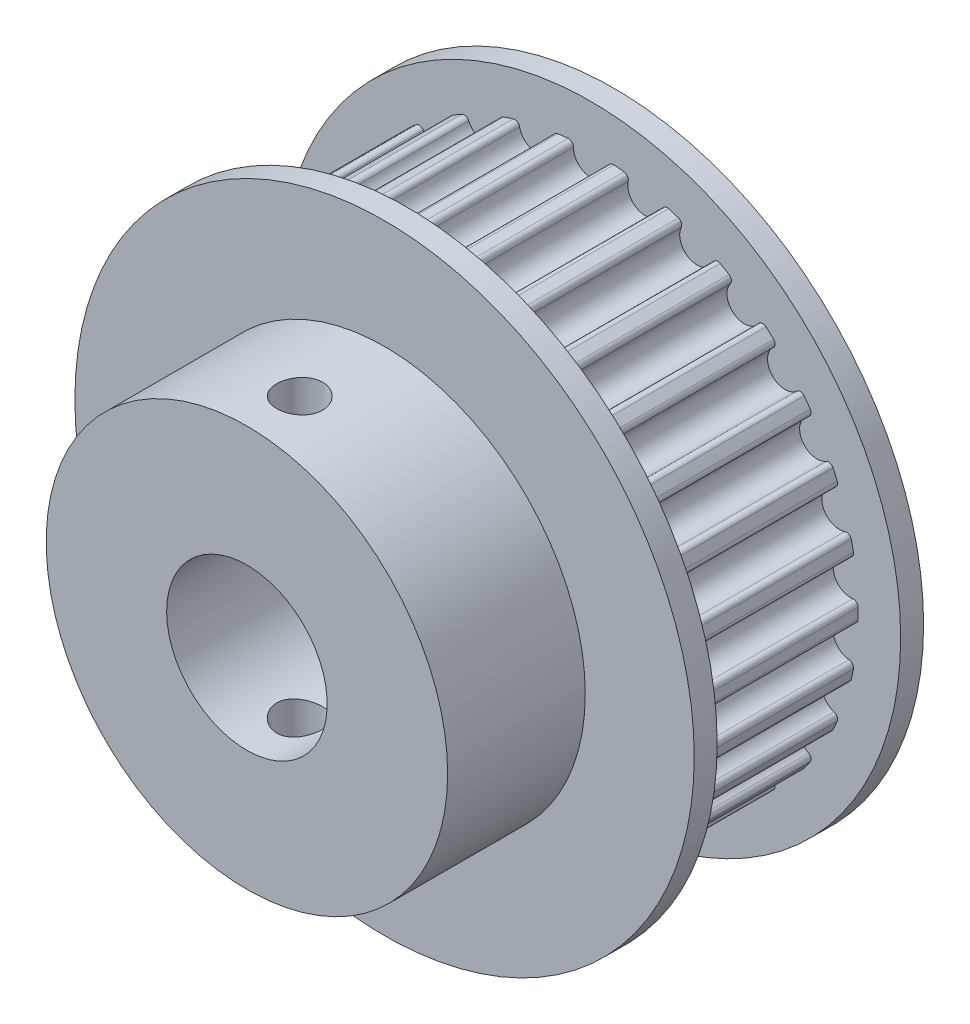
from build123d import *

# Parameters (mm, degrees)
BOSS_EXTRUDE1_DEPTH     = 16
SKETCH2_R               = 27
BOSS_EXTRUDE2_DEPTH     = 2
SKETCH4_R               = 17.5
BOSS_EXTRUDE3_DEPTH     = 12
SKETCH5_R               = 7
CUT_EXTRUDE2_DEPTH      = 50.819674828
CUT_EXTRUDE3_DEPTH      = 49.559242169
CUT_EXTRUDE3_DEPTH_BACK = 49.559242169
SKETCH6_R               = 2


with BuildPart() as part:
    # Sketch1 → Boss-Extrude1 (new body)
    with BuildSketch(Plane.XY):
        with BuildLine():
            ThreePointArc((0, 21.24), (1.084195411, 21.692551721), (1.524909511, 22.781612708))
            ThreePointArc((1.524909511, 22.781612708), (1.662392211, 23.101493006), (1.991639577, 23.214723169))
            ThreePointArc((1.991639577, 23.214723169), (2.435513194, 23.172360162), (2.878494872, 23.121510921))
            ThreePointArc((2.878494872, 23.121510921), (3.177005518, 22.942300732), (3.244977038, 22.600826326))
            ThreePointArc((3.244977038, 22.600826326), (3.449631966, 21.443934321), (4.416044313, 20.77585504))
            ThreePointArc((4.416044313, 20.77585504), (5.570638247, 20.993100519), (6.228150198, 21.966733296))
            ThreePointArc((6.228150198, 21.966733296), (6.429135424, 22.251039182), (6.774729819, 22.293340617))
            ThreePointArc((6.774729819, 22.293340617), (7.200095969, 22.15961683), (7.622825283, 22.017777697))
            ThreePointArc((7.622825283, 22.017777697), (7.877552862, 21.780419828), (7.873042519, 21.432275383))
            ThreePointArc((7.873042519, 21.432275383), (7.832693874, 20.258114092), (8.639086299, 19.40370552))
            ThreePointArc((8.639086299, 19.40370552), (9.81361746, 19.376150088), (10.659190834, 20.191802232))
            ThreePointArc((10.659190834, 20.191802232), (10.914894568, 20.428108173), (11.26173186, 20.397632105))
            ThreePointArc((11.26173186, 20.397632105), (11.65, 20.178391908), (12.03400165, 19.951761934))
            ThreePointArc((12.03400165, 19.951761934), (12.233813345, 19.666630062), (12.157018264, 19.327031162))
            ThreePointArc((12.157018264, 19.327031162), (11.873429474, 18.186917067), (12.484558759, 17.183520961))
            ThreePointArc((12.484558759, 17.183520961), (13.627694499, 16.912368921), (14.624373683, 17.534392518))
            ThreePointArc((14.624373683, 17.534392518), (14.923620445, 17.712370812), (15.256542179, 17.610449192))
            ThreePointArc((15.256542179, 17.610449192), (15.590743128, 17.315274434), (15.9192344, 17.013758436))
            ThreePointArc((15.9192344, 17.013758436), (16.05539748, 16.693314192), (15.909673974, 16.377102938))
            ThreePointArc((15.909673974, 16.377102938), (15.39523923, 15.320864497), (15.784396093, 14.212334079))
            ThreePointArc((15.784396093, 14.212334079), (16.846175896, 13.709436077), (17.950401226, 14.110645712))
            ThreePointArc((17.950401226, 14.110645712), (18.280112496, 14.222517853), (18.584568395, 14.053605145))
            ThreePointArc((18.584568395, 14.053605145), (18.850095969, 13.695396378), (19.108720217, 13.332172053))
            ThreePointArc((19.108720217, 13.332172053), (19.175283703, 12.990420389), (18.967000589, 12.711416729))
            ThreePointArc((18.967000589, 12.711416729), (18.244203158, 11.78521663), (18.394379576, 10.62))
            ThreePointArc((18.394379576, 10.62), (19.328398569, 9.907335092), (20.4919101, 10.070195979))
            ThreePointArc((20.4919101, 10.070195979), (20.837675914, 10.111072617), (21.100359794, 9.882551116))
            ThreePointArc((21.100359794, 9.882551116), (21.285609163, 9.476963784), (21.463063268, 9.067905776))
            ThreePointArc((21.463063268, 9.067905776), (21.457118015, 8.719782879), (21.195378264, 8.490180614))
            ThreePointArc((21.195378264, 8.490180614), (20.295807862, 7.734498244), (20.200440406, 6.563520961))
            ThreePointArc((20.200440406, 6.563520961), (20.965877477, 5.672236022), (22.137824172, 5.589630358))
            ThreePointArc((22.137824172, 5.589630358), (22.484532904, 5.557724989), (22.693964219, 5.279582181))
            ThreePointArc((22.693964219, 5.279582181), (22.790839097, 4.844342396), (22.879367462, 4.407328505))
            ThreePointArc((22.879367462, 4.407328505), (22.801173307, 4.068049016), (22.497416202, 3.897882865))
            ThreePointArc((22.497416202, 3.897882865), (21.460388373, 3.345745171), (21.123645058, 2.22018456))
            ThreePointArc((21.123645058, 2.22018456), (21.687046934, 1.18923302), (22.816209098, 0.86477107))
            ThreePointArc((22.816209098, 0.86477107), (23.148707913, 0.76147811), (23.29573351, 0.445870171))
            ThreePointArc((23.29573351, 0.445870171), (23.3, 0), (23.29573351, -0.445870171))
            ThreePointArc((23.29573351, -0.445870171), (23.148707913, -0.76147811), (22.816209098, -0.86477107))
            ThreePointArc((22.816209098, -0.86477107), (21.687046934, -1.18923302), (21.123645058, -2.22018456))
            ThreePointArc((21.123645058, -2.22018456), (21.460388373, -3.345745171), (22.497416202, -3.897882865))
            ThreePointArc((22.497416202, -3.897882865), (22.801173307, -4.068049016), (22.879367462, -4.407328505))
            ThreePointArc((22.879367462, -4.407328505), (22.790839097, -4.844342396), (22.693964219, -5.279582181))
            ThreePointArc((22.693964219, -5.279582181), (22.484532904, -5.557724989), (22.137824172, -5.589630358))
            ThreePointArc((22.137824172, -5.589630358), (20.965877477, -5.672236022), (20.200440406, -6.563520961))
            ThreePointArc((20.200440406, -6.563520961), (20.295807862, -7.734498244), (21.195378264, -8.490180614))
            ThreePointArc((21.195378264, -8.490180614), (21.457118015, -8.719782879), (21.463063268, -9.067905776))
            ThreePointArc((21.463063268, -9.067905776), (21.285609163, -9.476963784), (21.100359794, -9.882551116))
            ThreePointArc((21.100359794, -9.882551116), (20.837675914, -10.111072617), (20.4919101, -10.070195979))
            ThreePointArc((20.4919101, -10.070195979), (19.328398569, -9.907335092), (18.394379576, -10.62))
            ThreePointArc((18.394379576, -10.62), (18.244203158, -11.78521663), (18.967000589, -12.711416729))
            ThreePointArc((18.967000589, -12.711416729), (19.175283703, -12.990420389), (19.108720217, -13.332172053))
            ThreePointArc((19.108720217, -13.332172053), (18.850095969, -13.695396378), (18.584568395, -14.053605145))
            ThreePointArc((18.584568395, -14.053605145), (18.280112496, -14.222517853), (17.950401226, -14.110645712))
            ThreePointArc((17.950401226, -14.110645712), (16.846175896, -13.709436077), (15.784396093, -14.212334079))
            ThreePointArc((15.784396093, -14.212334079), (15.39523923, -15.320864497), (15.909673974, -16.377102938))
            ThreePointArc((15.909673974, -16.377102938), (16.05539748, -16.693314192), (15.9192344, -17.013758436))
            ThreePointArc((15.9192344, -17.013758436), (15.590743128, -17.315274434), (15.256542179, -17.610449192))
            ThreePointArc((15.256542179, -17.610449192), (14.923620445, -17.712370812), (14.624373683, -17.534392518))
            ThreePointArc((14.624373683, -17.534392518), (13.627694499, -16.912368921), (12.484558759, -17.183520961))
            ThreePointArc((12.484558759, -17.183520961), (11.873429474, -18.186917067), (12.157018264, -19.327031162))
            ThreePointArc((12.157018264, -19.327031162), (12.233813345, -19.666630062), (12.03400165, -19.951761934))
            ThreePointArc((12.03400165, -19.951761934), (11.65, -20.178391908), (11.26173186, -20.397632105))
            ThreePointArc((11.26173186, -20.397632105), (10.914894568, -20.428108173), (10.659190834, -20.191802232))
            ThreePointArc((10.659190834, -20.191802232), (9.81361746, -19.376150088), (8.639086299, -19.40370552))
            ThreePointArc((8.639086299, -19.40370552), (7.832693874, -20.258114092), (7.873042519, -21.432275383))
            ThreePointArc((7.873042519, -21.432275383), (7.877552862, -21.780419828), (7.622825283, -22.017777697))
            ThreePointArc((7.622825283, -22.017777697), (7.200095969, -22.15961683), (6.774729819, -22.293340617))
            ThreePointArc((6.774729819, -22.293340617), (6.429135424, -22.251039182), (6.228150198, -21.966733296))
            ThreePointArc((6.228150198, -21.966733296), (5.570638247, -20.993100519), (4.416044313, -20.77585504))
            ThreePointArc((4.416044313, -20.77585504), (3.449631966, -21.443934321), (3.244977038, -22.600826326))
            ThreePointArc((3.244977038, -22.600826326), (3.177005518, -22.942300732), (2.878494872, -23.121510921))
            ThreePointArc((2.878494872, -23.121510921), (2.435513194, -23.172360162), (1.991639577, -23.214723169))
            ThreePointArc((1.991639577, -23.214723169), (1.662392211, -23.101493006), (1.524909511, -22.781612708))
            ThreePointArc((1.524909511, -22.781612708), (1.084195411, -21.692551721), (0, -21.24))
            ThreePointArc((0, -21.24), (-1.084195411, -21.692551721), (-1.524909511, -22.781612708))
            ThreePointArc((-1.524909511, -22.781612708), (-1.662392211, -23.101493006), (-1.991639577, -23.214723169))
            ThreePointArc((-1.991639577, -23.214723169), (-2.435513194, -23.172360162), (-2.878494872, -23.121510921))
            ThreePointArc((-2.878494872, -23.121510921), (-3.177005518, -22.942300732), (-3.244977038, -22.600826326))
            ThreePointArc((-3.244977038, -22.600826326), (-3.449631966, -21.443934321), (-4.416044313, -20.77585504))
            ThreePointArc((-4.416044313, -20.77585504), (-5.570638247, -20.993100519), (-6.228150198, -21.966733296))
            ThreePointArc((-6.228150198, -21.966733296), (-6.429135424, -22.251039182), (-6.774729819, -22.293340617))
            ThreePointArc((-6.774729819, -22.293340617), (-7.200095969, -22.15961683), (-7.622825283, -22.017777697))
            ThreePointArc((-7.622825283, -22.017777697), (-7.877552862, -21.780419828), (-7.873042519, -21.432275383))
            ThreePointArc((-7.873042519, -21.432275383), (-7.832693874, -20.258114092), (-8.639086299, -19.40370552))
            ThreePointArc((-8.639086299, -19.40370552), (-9.81361746, -19.376150088), (-10.659190834, -20.191802232))
            ThreePointArc((-10.659190834, -20.191802232), (-10.914894568, -20.428108173), (-11.26173186, -20.397632105))
            ThreePointArc((-11.26173186, -20.397632105), (-11.65, -20.178391908), (-12.03400165, -19.951761934))
            ThreePointArc((-12.03400165, -19.951761934), (-12.233813345, -19.666630062), (-12.157018264, -19.327031162))
            ThreePointArc((-12.157018264, -19.327031162), (-11.873429474, -18.186917067), (-12.484558759, -17.183520961))
            ThreePointArc((-12.484558759, -17.183520961), (-13.627694499, -16.912368921), (-14.624373683, -17.534392518))
            ThreePointArc((-14.624373683, -17.534392518), (-14.923620445, -17.712370812), (-15.256542179, -17.610449192))
            ThreePointArc((-15.256542179, -17.610449192), (-15.590743128, -17.315274434), (-15.9192344, -17.013758436))
            ThreePointArc((-15.9192344, -17.013758436), (-16.05539748, -16.693314192), (-15.909673974, -16.377102938))
            ThreePointArc((-15.909673974, -16.377102938), (-15.39523923, -15.320864497), (-15.784396093, -14.212334079))
            ThreePointArc((-15.784396093, -14.212334079), (-16.846175896, -13.709436077), (-17.950401226, -14.110645712))
            ThreePointArc((-17.950401226, -14.110645712), (-18.280112496, -14.222517853), (-18.584568395, -14.053605145))
            ThreePointArc((-18.584568395, -14.053605145), (-18.850095969, -13.695396378), (-19.108720217, -13.332172053))
            ThreePointArc((-19.108720217, -13.332172053), (-19.175283703, -12.990420389), (-18.967000589, -12.711416729))
            ThreePointArc((-18.967000589, -12.711416729), (-18.244203158, -11.78521663), (-18.394379576, -10.62))
            ThreePointArc((-18.394379576, -10.62), (-19.328398569, -9.907335092), (-20.4919101, -10.070195979))
            ThreePointArc((-20.4919101, -10.070195979), (-20.837675914, -10.111072617), (-21.100359794, -9.882551116))
            ThreePointArc((-21.100359794, -9.882551116), (-21.285609163, -9.476963784), (-21.463063268, -9.067905776))
            ThreePointArc((-21.463063268, -9.067905776), (-21.457118015, -8.719782879), (-21.195378264, -8.490180614))
            ThreePointArc((-21.195378264, -8.490180614), (-20.295807862, -7.734498244), (-20.200440406, -6.563520961))
            ThreePointArc((-20.200440406, -6.563520961), (-20.965877477, -5.672236022), (-22.137824172, -5.589630358))
            ThreePointArc((-22.137824172, -5.589630358), (-22.484532904, -5.557724989), (-22.693964219, -5.279582181))
            ThreePointArc((-22.693964219, -5.279582181), (-22.790839097, -4.844342396), (-22.879367462, -4.407328505))
            ThreePointArc((-22.879367462, -4.407328505), (-22.801173307, -4.068049016), (-22.497416202, -3.897882865))
            ThreePointArc((-22.497416202, -3.897882865), (-21.460388373, -3.345745171), (-21.123645058, -2.22018456))
            ThreePointArc((-21.123645058, -2.22018456), (-21.687046934, -1.18923302), (-22.816209098, -0.86477107))
            ThreePointArc((-22.816209098, -0.86477107), (-23.148707913, -0.76147811), (-23.29573351, -0.445870171))
            ThreePointArc((-23.29573351, -0.445870171), (-23.3, 0), (-23.29573351, 0.445870171))
            ThreePointArc((-23.29573351, 0.445870171), (-23.148707913, 0.76147811), (-22.816209098, 0.86477107))
            ThreePointArc((-22.816209098, 0.86477107), (-21.687046934, 1.18923302), (-21.123645058, 2.22018456))
            ThreePointArc((-21.123645058, 2.22018456), (-21.460388373, 3.345745171), (-22.497416202, 3.897882865))
            ThreePointArc((-22.497416202, 3.897882865), (-22.801173307, 4.068049016), (-22.879367462, 4.407328505))
            ThreePointArc((-22.879367462, 4.407328505), (-22.790839097, 4.844342396), (-22.693964219, 5.279582181))
            ThreePointArc((-22.693964219, 5.279582181), (-22.484532904, 5.557724989), (-22.137824172, 5.589630358))
            ThreePointArc((-22.137824172, 5.589630358), (-20.965877477, 5.672236022), (-20.200440406, 6.563520961))
            ThreePointArc((-20.200440406, 6.563520961), (-20.295807862, 7.734498244), (-21.195378264, 8.490180614))
            ThreePointArc((-21.195378264, 8.490180614), (-21.457118015, 8.719782879), (-21.463063268, 9.067905776))
            ThreePointArc((-21.463063268, 9.067905776), (-21.285609163, 9.476963784), (-21.100359794, 9.882551116))
            ThreePointArc((-21.100359794, 9.882551116), (-20.837675914, 10.111072617), (-20.4919101, 10.070195979))
            ThreePointArc((-20.4919101, 10.070195979), (-19.328398569, 9.907335092), (-18.394379576, 10.62))
            ThreePointArc((-18.394379576, 10.62), (-18.244203158, 11.78521663), (-18.967000589, 12.711416729))
            ThreePointArc((-18.967000589, 12.711416729), (-19.175283703, 12.990420389), (-19.108720217, 13.332172053))
            ThreePointArc((-19.108720217, 13.332172053), (-18.850095969, 13.695396378), (-18.584568395, 14.053605145))
            ThreePointArc((-18.584568395, 14.053605145), (-18.280112496, 14.222517853), (-17.950401226, 14.110645712))
            ThreePointArc((-17.950401226, 14.110645712), (-16.846175896, 13.709436077), (-15.784396093, 14.212334079))
            ThreePointArc((-15.784396093, 14.212334079), (-15.39523923, 15.320864497), (-15.909673974, 16.377102938))
            ThreePointArc((-15.909673974, 16.377102938), (-16.05539748, 16.693314192), (-15.9192344, 17.013758436))
            ThreePointArc((-15.9192344, 17.013758436), (-15.590743128, 17.315274434), (-15.256542179, 17.610449192))
            ThreePointArc((-15.256542179, 17.610449192), (-14.923620445, 17.712370812), (-14.624373683, 17.534392518))
            ThreePointArc((-14.624373683, 17.534392518), (-13.627694499, 16.912368921), (-12.484558759, 17.183520961))
            ThreePointArc((-12.484558759, 17.183520961), (-11.873429474, 18.186917067), (-12.157018264, 19.327031162))
            ThreePointArc((-12.157018264, 19.327031162), (-12.233813345, 19.666630062), (-12.03400165, 19.951761934))
            ThreePointArc((-12.03400165, 19.951761934), (-11.65, 20.178391908), (-11.26173186, 20.397632105))
            ThreePointArc((-11.26173186, 20.397632105), (-10.914894568, 20.428108173), (-10.659190834, 20.191802232))
            ThreePointArc((-10.659190834, 20.191802232), (-9.81361746, 19.376150088), (-8.639086299, 19.40370552))
            ThreePointArc((-8.639086299, 19.40370552), (-7.832693874, 20.258114092), (-7.873042519, 21.432275383))
            ThreePointArc((-7.873042519, 21.432275383), (-7.877552862, 21.780419828), (-7.622825283, 22.017777697))
            ThreePointArc((-7.622825283, 22.017777697), (-7.200095969, 22.15961683), (-6.774729819, 22.293340617))
            ThreePointArc((-6.774729819, 22.293340617), (-6.429135424, 22.251039182), (-6.228150198, 21.966733296))
            ThreePointArc((-6.228150198, 21.966733296), (-5.570638247, 20.993100519), (-4.416044313, 20.77585504))
            ThreePointArc((-4.416044313, 20.77585504), (-3.449631966, 21.443934321), (-3.244977038, 22.600826326))
            ThreePointArc((-3.244977038, 22.600826326), (-3.177005518, 22.942300732), (-2.878494872, 23.121510921))
            ThreePointArc((-2.878494872, 23.121510921), (-2.435513194, 23.172360162), (-1.991639577, 23.214723169))
            ThreePointArc((-1.991639577, 23.214723169), (-1.662392211, 23.101493006), (-1.524909511, 22.781612708))
            ThreePointArc((-1.524909511, 22.781612708), (-1.084195411, 21.692551721), (0, 21.24))
        make_face()
    extrude(amount=BOSS_EXTRUDE1_DEPTH)

    # Sketch2 → Boss-Extrude2 (add)
    with BuildSketch(Plane.XY.offset(16)):
        Circle(SKETCH2_R)
    boss_extrude2 = extrude(amount=BOSS_EXTRUDE2_DEPTH)

    # Mirror2: Boss-Extrude2 across plane
    add(boss_extrude2.mirror(Plane(origin=(0, 0, 8), x_dir=(1, 0, 0), z_dir=(0, 0, -1))))

    # Sketch4 → Boss-Extrude3 (add)
    with BuildSketch(Plane.XY.offset(18)):
        Circle(SKETCH4_R)
    extrude(amount=BOSS_EXTRUDE3_DEPTH)

    # Sketch5 → Cut-Extrude2 (cut, through all)
    with BuildSketch(Plane(origin=(0, 0, -2), x_dir=(-1, 0, 0), z_dir=(0, 0, -1))):
        Circle(SKETCH5_R)
    extrude(amount=-CUT_EXTRUDE2_DEPTH, mode=Mode.SUBTRACT)

    # Sketch6 → Cut-Extrude3 (cut, two sides: drawn at the far end of the back side and taken through both)
    with BuildSketch(Plane(origin=(0, 0, 0), x_dir=(1, 0, 0), z_dir=(0, 1, 0)).offset(-CUT_EXTRUDE3_DEPTH_BACK)):
        with Locations(Location((0, -25.4, 0), (0, 0, 270))):
            Circle(SKETCH6_R)
    extrude(amount=CUT_EXTRUDE3_DEPTH + CUT_EXTRUDE3_DEPTH_BACK, mode=Mode.SUBTRACT)


solid = part.part
